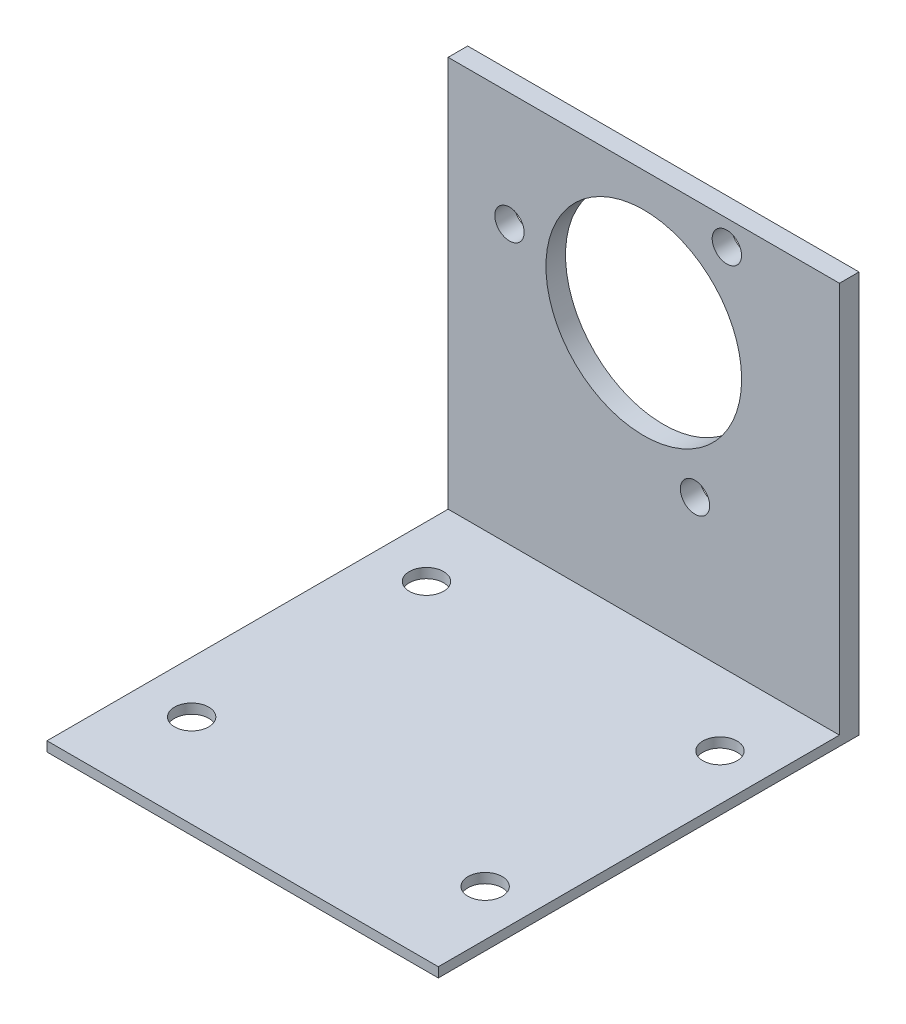
from build123d import *

# Parameters (mm, degrees)
SKETCH1_W           = 40
SKETCH1_H           = 43
SKETCH1_R           = 1.75
BOSS_EXTRUDE1_DEPTH = 1
SKETCH4_W           = 40
SKETCH4_H           = 2
BOSS_EXTRUDE2_DEPTH = 40
SKETCH5_R           = 1.5
SKETCH5_R_2         = 10
CUT_EXTRUDE1_DEPTH  = 24


with BuildPart() as part:
    # Sketch1 → Boss-Extrude1 (new body)
    with BuildSketch(Plane(origin=(0, 0, 0), x_dir=(1, 0, 0), z_dir=(0, 1, 0))):
        Rectangle(SKETCH1_W, SKETCH1_H)
        with Locations(Location((-14.715053003, 12, 0), (0, 0, 270))):
            Circle(SKETCH1_R, mode=Mode.SUBTRACT)
        with Locations(Location((15.284946997, 12, 0), (0, 0, 270))):
            Circle(SKETCH1_R, mode=Mode.SUBTRACT)
        with Locations(Location((-14.715053003, -12, 0), (0, 0, 270))):
            Circle(SKETCH1_R, mode=Mode.SUBTRACT)
        with Locations(Location((15.284946997, -12, 0), (0, 0, 270))):
            Circle(SKETCH1_R, mode=Mode.SUBTRACT)
    extrude(amount=-BOSS_EXTRUDE1_DEPTH)

    # Sketch4 → Boss-Extrude2 (add)
    with BuildSketch(Plane(origin=(0, 0, 0), x_dir=(1, 0, 0), z_dir=(0, 1, 0))):
        with Locations((0, 20.5)):
            Rectangle(SKETCH4_W, SKETCH4_H)
    extrude(amount=BOSS_EXTRUDE2_DEPTH)

    # Sketch5 → Cut-Extrude1 (cut)
    with BuildSketch(Plane.XY.offset(-19.5)):
        with Locations((8.491960292, 37.449274423)):
            Circle(SKETCH5_R)
        with Locations((-13.72832995, 28.379616129)):
            Circle(SKETCH5_R)
        with Locations((5.236369657, 13.671109447)):
            Circle(SKETCH5_R)
        with Locations((0, 26.5)):
            Circle(SKETCH5_R_2)
    extrude(amount=-CUT_EXTRUDE1_DEPTH, mode=Mode.SUBTRACT)


solid = part.part
